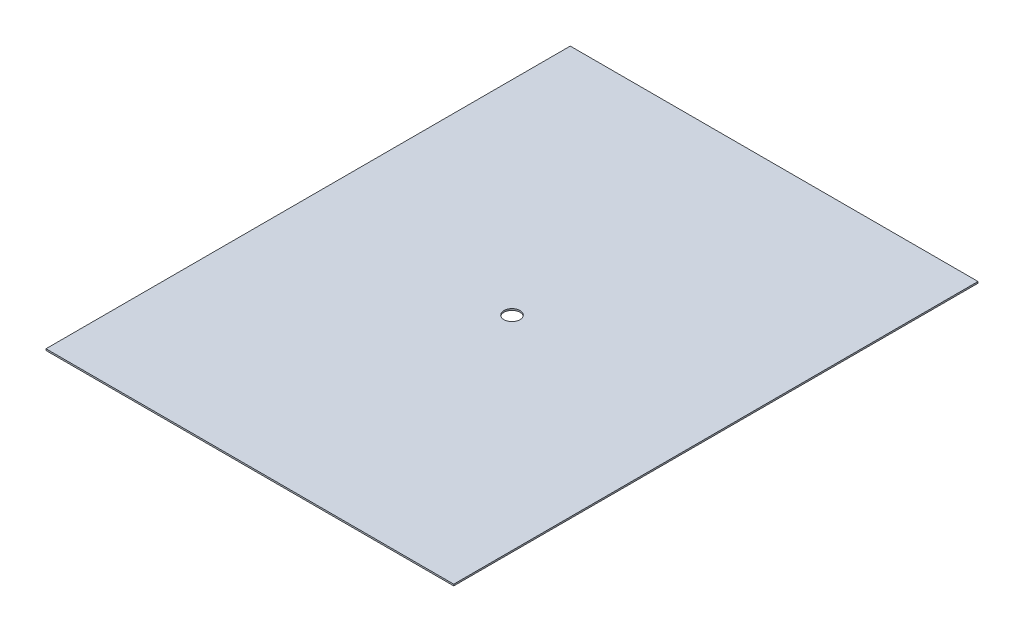
from build123d import *

# Parameters (mm, degrees)
SKETCH1_W           = 200.025
SKETCH1_H           = 257.175
SKETCH1_R           = 3.9116
BOSS_EXTRUDE1_DEPTH = 0.762


with BuildPart() as part:
    # Sketch1 → Boss-Extrude1 (new body)
    with BuildSketch(Plane(origin=(0, 0, 0), x_dir=(1, 0, 0), z_dir=(0, 1, 0))):
        Rectangle(SKETCH1_W, SKETCH1_H)
        with Locations(Location((0, 0, 0), (0, 0, 90))):
            Circle(SKETCH1_R, mode=Mode.SUBTRACT)
    extrude(amount=BOSS_EXTRUDE1_DEPTH)


solid = part.part
